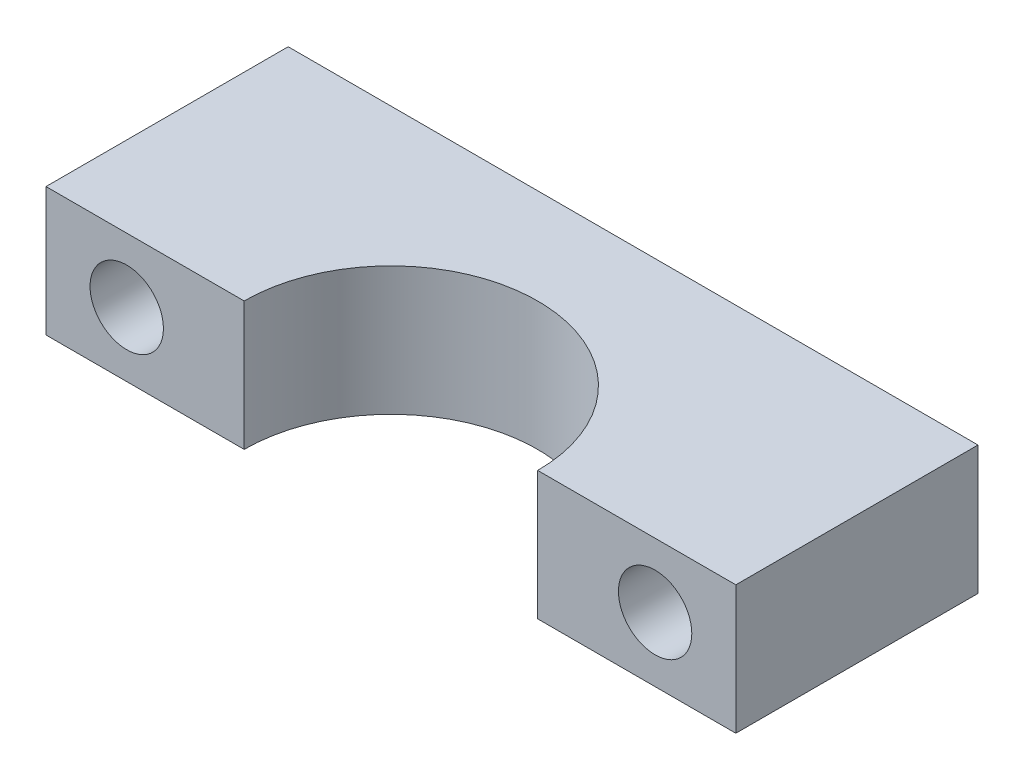
from build123d import *

# Parameters (mm, degrees)
BOSS_EXTRUDE1_DEPTH = 5.5626
SKETCH2_R           = 3.175
CUT_EXTRUDE1_DEPTH  = 37.888732274


with BuildPart() as part:
    # Sketch1 → Boss-Extrude1 (new, symmetric)
    with BuildSketch(Plane(origin=(0, 0, 0), x_dir=(1, 0, 0), z_dir=(0, 1, 0))):
        with BuildLine():
            Line((-12.7, 0), (-29.845, 0))
            Line((-29.845, 0), (-29.845, 20.955))
            Line((-29.845, 20.955), (29.845, 20.955))
            Line((29.845, 20.955), (29.845, 0))
            Line((29.845, 0), (12.7, 0))
            ThreePointArc((12.7, 0), (0, 12.7), (-12.7, 0))
        make_face()
    extrude(amount=BOSS_EXTRUDE1_DEPTH, both=True)

    # Sketch2 → Cut-Extrude1 (cut, through all)
    with BuildSketch(Plane.XY):
        with Locations((-22.86, 0)):
            Circle(SKETCH2_R)
        with Locations((22.86, 0)):
            Circle(SKETCH2_R)
    extrude(amount=-CUT_EXTRUDE1_DEPTH, mode=Mode.SUBTRACT)


solid = part.part
